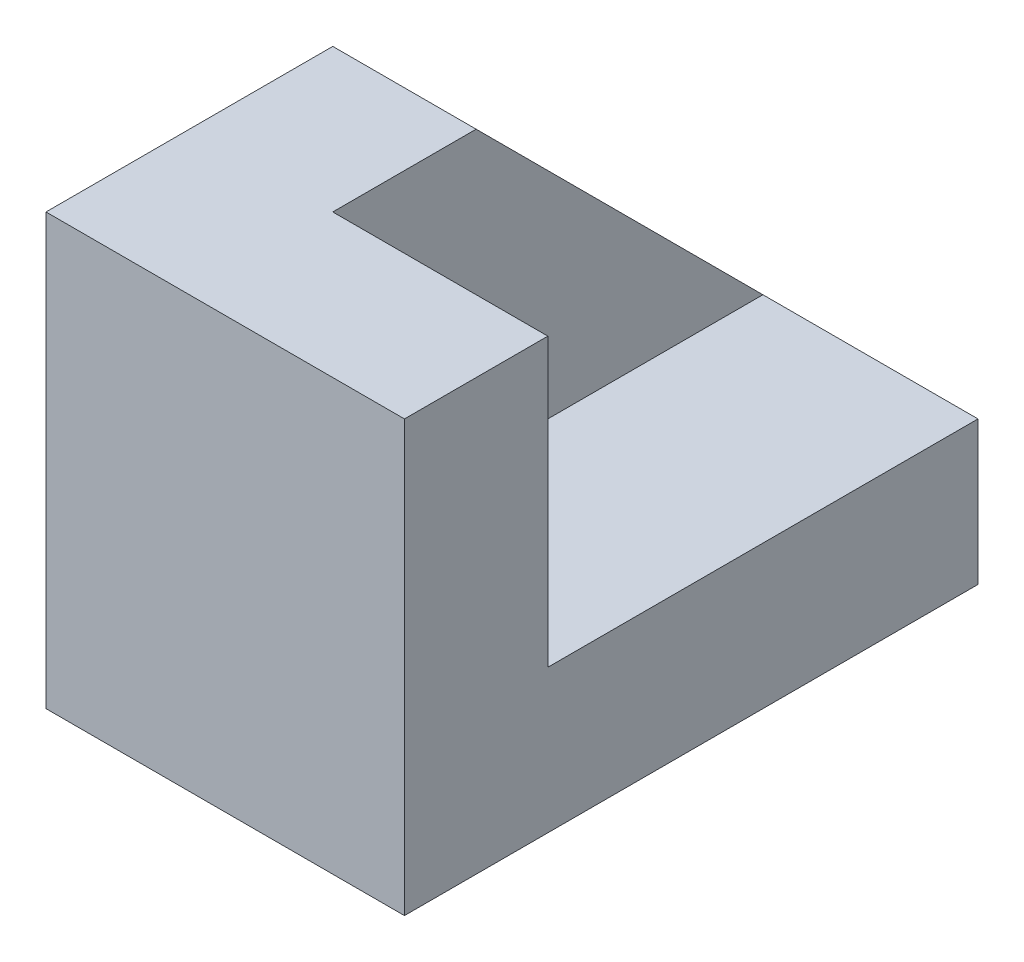
from build123d import *

# Parameters (mm, degrees)
SALIENTE_EXTRUIR2_DEPTH = 5
CROQUIS4_W              = 3
CROQUIS4_H              = 6
CORTAR_EXTRUIR1_DEPTH   = 4


with BuildPart() as part:
    # Croquis2 → Saliente-Extruir2 (new body)
    with BuildSketch(Plane(origin=(0, 0, 0), x_dir=(0, 0, -1), z_dir=(1, 0, 0))):
        Polygon((0, 3), (4, -1), (4, -3), (-4, -3), (-4, 3), align=None)
    extrude(amount=SALIENTE_EXTRUIR2_DEPTH)

    # Croquis4 → Cortar-Extruir1 (cut)
    with BuildSketch(Plane(origin=(0, 3, 0), x_dir=(1, 0, 0), z_dir=(0, 1, 0))):
        with Locations((3.5, 1)):
            Rectangle(CROQUIS4_W, CROQUIS4_H)
    extrude(amount=-CORTAR_EXTRUIR1_DEPTH, mode=Mode.SUBTRACT)


solid = part.part
